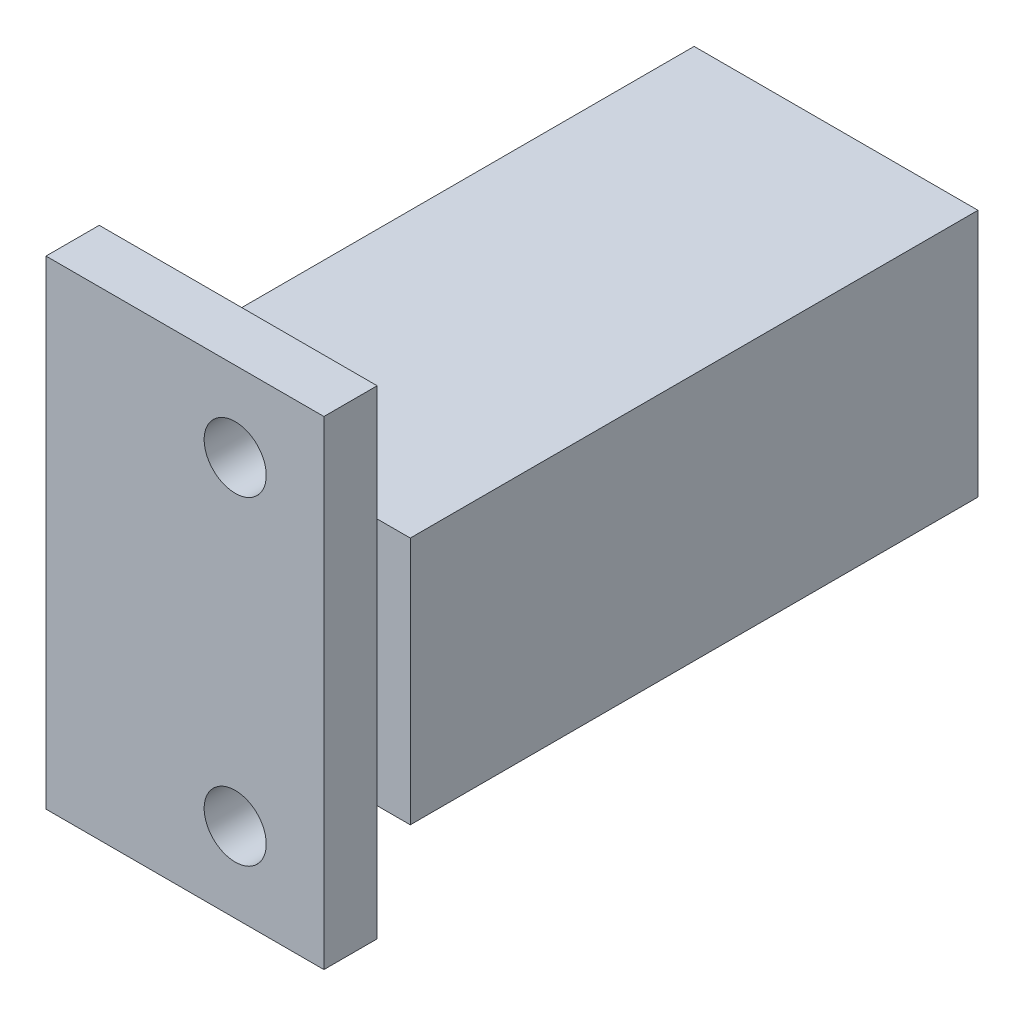
from build123d import *

# Parameters (mm, degrees)
BOSS_EXTRUDE1_DEPTH      = 1.5
SKETCH2_W                = 14
SKETCH2_H                = 32
BOSS_EXTRUDE2_DEPTH      = 16
BOSS_EXTRUDE3_DEPTH      = 3
BOSS_EXTRUDE3_DEPTH_BACK = 0.001
SKETCH3_W                = 15.664729633
SKETCH3_H                = 27
SKETCH3_R                = 1.75
SKETCH5_R                = 2.5
BOSS_EXTRUDE4_DEPTH      = 4
BOSS_EXTRUDE4_TAPER      = 15
CUT_EXTRUDE1_DEPTH       = 10
SKETCH7_W                = 71.065748979
SKETCH7_H                = 70.277880365
CUT_EXTRUDE2_DEPTH       = 30


with BuildPart() as part:
    # Sketch1 → Boss-Extrude1 (new body)
    with BuildSketch(Plane.YZ):
        Polygon((-13.5, 8), (-13.5, -8), (13.5, -8), (13.5, 8), (5, 8), (5, 58), (-5, 58), (-5, 8), align=None)
    extrude(amount=-BOSS_EXTRUDE1_DEPTH)



with BuildPart() as body_2:
    # Sketch2 → Boss-Extrude2 (new body)
    with BuildSketch(Plane.YZ):
        with Locations((0, -24)):
            Rectangle(SKETCH2_W, SKETCH2_H)
    extrude(amount=BOSS_EXTRUDE2_DEPTH)


with BuildPart() as part_1:
    add(part.part)

    add(body_2.part)  # Boss-Extrude3 merges body 2
    # Sketch3 → Boss-Extrude3 (add, two sides: drawn at the far end of the back side and taken through both)
    with BuildSketch(Plane.XY.offset(-8).offset(-BOSS_EXTRUDE3_DEPTH_BACK)):
        with Locations((6.299899253, 0)):
            Rectangle(SKETCH3_W, SKETCH3_H)
        with Locations((9.132264069, 9)):
            Circle(SKETCH3_R, mode=Mode.SUBTRACT)
        with Locations((9.132264069, -9)):
            Circle(SKETCH3_R, mode=Mode.SUBTRACT)
    extrude(amount=BOSS_EXTRUDE3_DEPTH + BOSS_EXTRUDE3_DEPTH_BACK)

    # Sketch5 → Boss-Extrude4 (add)
    with BuildSketch(Plane(origin=(0, 0, -40), x_dir=(1, 0, 0), z_dir=(0, 0, -1))):
        with Locations((9, 0)):
            Circle(SKETCH5_R)
    extrude(amount=BOSS_EXTRUDE4_DEPTH, taper=BOSS_EXTRUDE4_TAPER)

    # Sketch6 → Cut-Extrude1 (cut)
    with BuildSketch(Plane.YZ):
        with BuildLine():
            Line((0.555279177, 48), (0.555279177, 18))
            ThreePointArc((0.555279177, 18), (-1.194720823, 16.25), (-2.944720823, 18))
            Line((-2.944720823, 18), (-2.944720823, 48))
            ThreePointArc((-2.944720823, 48), (-1.194720823, 49.75), (0.555279177, 48))
        make_face()
    extrude(amount=-CUT_EXTRUDE1_DEPTH, mode=Mode.SUBTRACT)

    # Sketch7 → Cut-Extrude2 (cut)
    with BuildSketch(Plane.YZ.offset(14.132264069)):
        with Locations((0.078786861, 30.138940183)):
            Rectangle(SKETCH7_W, SKETCH7_H)
    extrude(amount=-CUT_EXTRUDE2_DEPTH, mode=Mode.SUBTRACT)


solid = part_1.part
